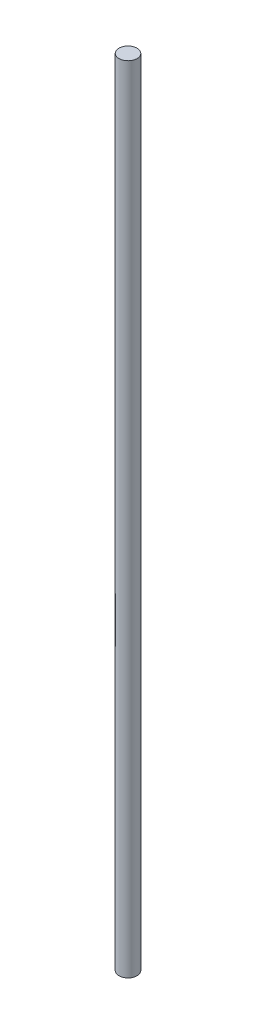
from build123d import *

# Parameters (mm, degrees)
SKETCH1_W = 5
SKETCH1_H = 439.4


with BuildPart() as part:
    # Sketch1 → Revolve1 (revolve)
    with BuildSketch(Plane.XY, mode=Mode.PRIVATE) as revolve1_sk:
        with Locations((2.5, 219.7)):
            Rectangle(SKETCH1_W, SKETCH1_H)
    revolve(revolve1_sk.sketch.rotate(Axis((0, 0, 0), (0, 1, 0)), 90), axis=Axis((0, 0, 0), (0, 1, 0)))


solid = part.part
